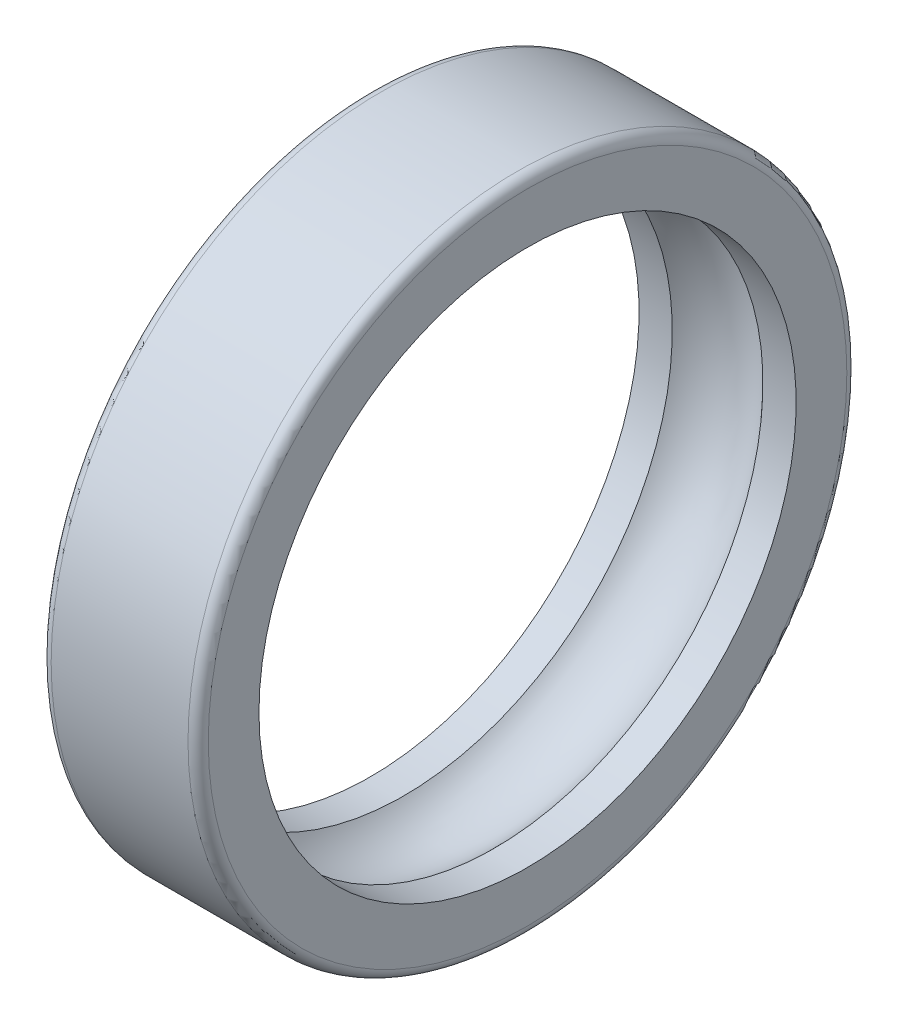
from build123d import *

# Parameters (mm, degrees)
FILLET_1_R    = 2
SCALE_1_SCALE = 0.338461538
SCALE_2_SCALE = 0.5


with BuildPart() as part:
    # 草图1 → 旋转1 (revolve)
    with BuildSketch(Plane.XY, mode=Mode.PRIVATE) as revolve_1_sk:
        with BuildLine():
            Line((-15.5, 53), (-8.94427191, 53))
            ThreePointArc((-8.94427191, 53), (0, 57), (8.94427191, 53))
            Line((8.94427191, 53), (15.5, 53))
            Line((15.5, 53), (15.5, 65))
            Line((15.5, 65), (-15.5, 65))
            Line((-15.5, 65), (-15.5, 53))
        make_face()
    revolve(revolve_1_sk.sketch.rotate(Axis((0, 0, 0), (1, 0, 0)), 90), axis=Axis((0, 0, 0), (1, 0, 0)))

    # 圆角1
    fillet_1_edges = [part.edges().sort_by_distance(p)[0] for p in [
        (15.5, 0, -65),
        (-15.5, 0, -65),
    ]]
    fillet(fillet_1_edges, radius=FILLET_1_R)


with BuildPart() as part_1:
    # 缩放比例1: scaled about (0, 0, 0)
    add(part.part.scale(SCALE_1_SCALE))


with BuildPart() as part_2:
    # 缩放比例2: scaled about (0, 0, 0)
    add(part_1.part.scale(SCALE_2_SCALE))


solid = part_2.part
